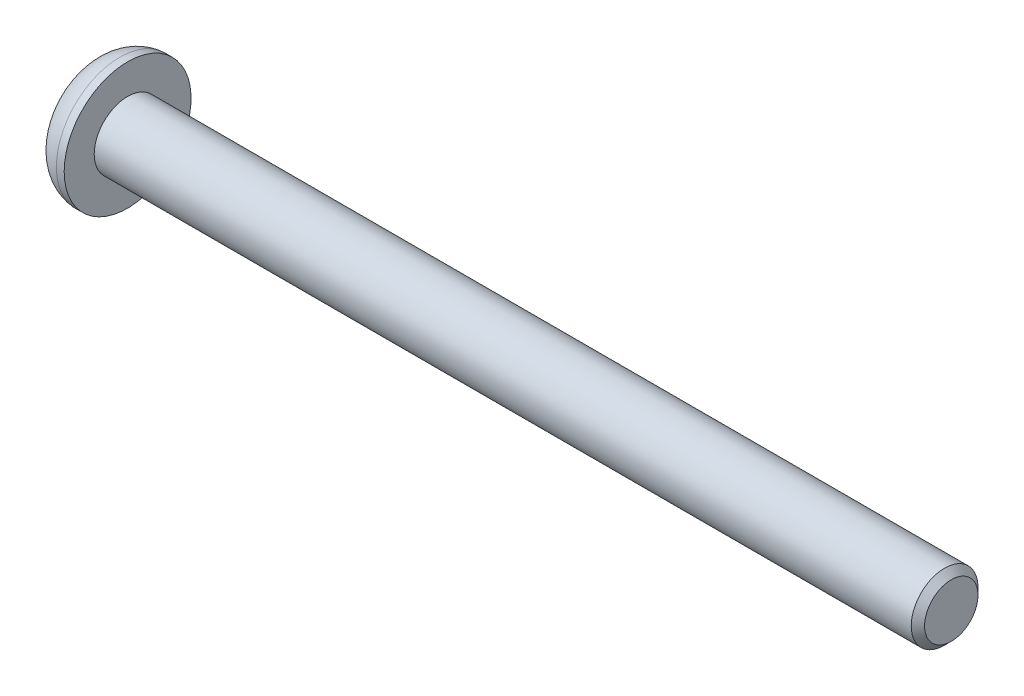
from build123d import *

# Parameters (mm, degrees)
KES_EKSTR_ZYON1_DEPTH = 1


with BuildPart() as part:
    # Çizim1 → Döndür1 (revolve)
    with BuildSketch(Plane.XY, mode=Mode.PRIVATE) as d_nd_r1_sk:
        with BuildLine():
            Line((-17.895152368, 0), (-17.895152368, 1.425))
            ThreePointArc((-17.895152368, 1.425), (-17.521324038, 2.389446085), (-16.595152368, 2.85))
            Line((-16.595152368, 2.85), (-16.245152368, 2.85))
            Line((-16.245152368, 2.85), (-16.245152368, 1.5))
            Line((-16.245152368, 1.5), (20.454847632, 1.5))
            Line((20.454847632, 1.5), (20.754847632, 1.2))
            Line((20.754847632, 1.2), (20.754847632, 0))
            Line((20.754847632, 0), (-17.895152368, 0))
        make_face()
    revolve(d_nd_r1_sk.sketch.rotate(Axis((-8.74874301, 0, 0), (1, 0, 0)), 90), axis=Axis((-8.74874301, 0, 0), (1, 0, 0)))

    # Çizim2 → Kes-Ekstrüzyon1 (cut)
    with BuildSketch(Plane.ZY.offset(17.895152368)):
        Polygon((0, 1.154700538), (-1, 0.577350269), (-1, -0.577350269), (0, -1.154700538), (1, -0.577350269), (1, 0.577350269), align=None)
    extrude(amount=-KES_EKSTR_ZYON1_DEPTH, mode=Mode.SUBTRACT)


solid = part.part
